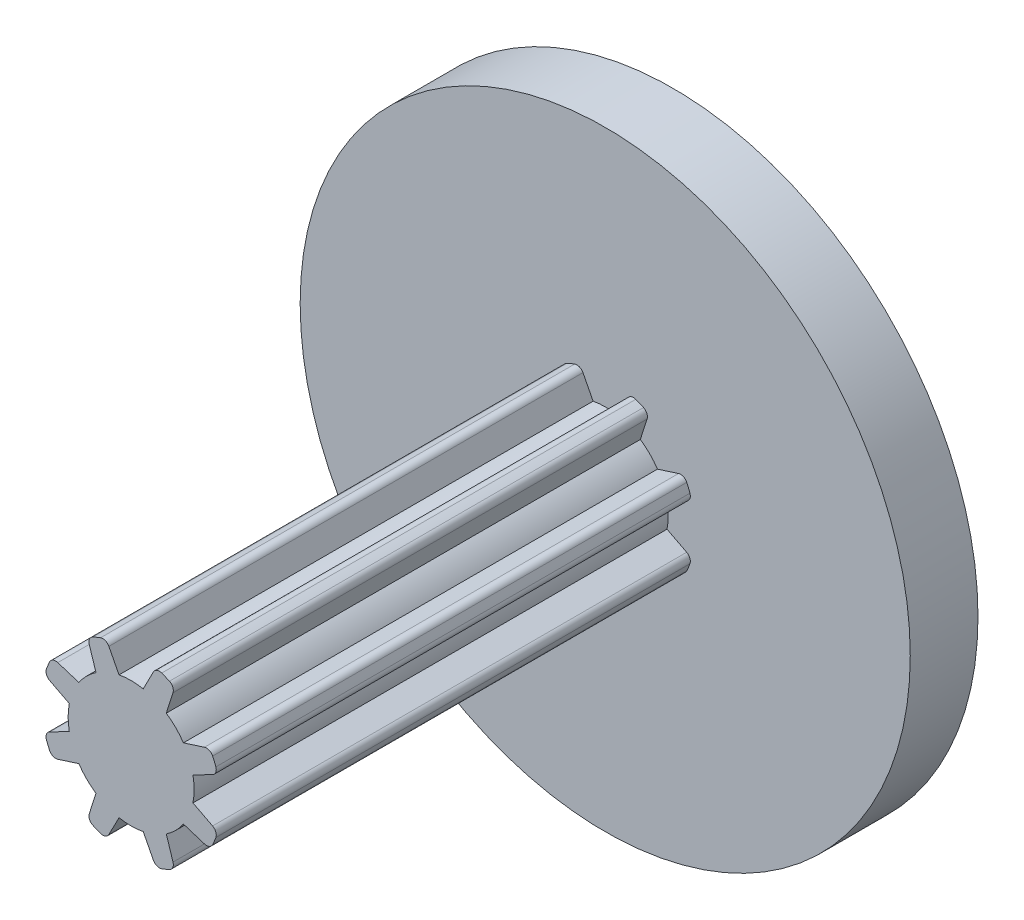
from build123d import *

# Parameters (mm, degrees)
SKETCH2_R           = 4.137132353
BOSS_EXTRUDE1_DEPTH = 40
SKETCH2_4_R         = 22.521813525
BOSS_EXTRUDE2_DEPTH = 5
BOSS_EXTRUDE3_DEPTH = 35
SKETCH6_R           = 3.1
CUT_EXTRUDE1_DEPTH  = 17


with BuildPart() as part:
    # Sketch2 → Boss-Extrude1 (new body)
    with BuildSketch(Plane.XY.offset(-16.453858319)):
        Circle(SKETCH2_R)
    extrude(amount=BOSS_EXTRUDE1_DEPTH)

    # Sketch2<4> → Boss-Extrude2 (add)
    with BuildSketch(Plane.XY.offset(-16.453858319)):
        Circle(SKETCH2_4_R)
    extrude(amount=BOSS_EXTRUDE2_DEPTH)

    # Sketch5 → Boss-Extrude3 (add)
    with BuildSketch(Plane.XY.offset(-11.453858319)):
        with BuildLine():
            Line((3.09152076, 5.413957434), (2.594362934, 3.858987039))
            ThreePointArc((2.594362934, 3.858987039), (3.287908356, 3.288184703), (3.85876898, 2.594687257))
            Line((3.85876898, 2.594687257), (5.413697585, 3.091975771))
            ThreePointArc((5.413697585, 3.091975771), (5.765755257, 3.074104639), (6.018526007, 2.828399672))
            ThreePointArc((6.018526007, 2.828399672), (6.143691944, 2.545103004), (6.25553153, 2.256285725))
            ThreePointArc((6.25553153, 2.256285725), (6.250564892, 1.903809747), (6.014281308, 1.642210721))
            Line((6.014281308, 1.642210721), (4.563207527, 0.894224281))
            ThreePointArc((4.563207527, 0.894224281), (4.649999996, 0.000195407), (4.563282667, -0.893840758))
            Line((4.563282667, -0.893840758), (6.014419308, -1.641705239))
            ThreePointArc((6.014419308, -1.641705239), (6.250724877, -1.903284405), (6.25572114, -2.255759964))
            ThreePointArc((6.25572114, -2.255759964), (6.143905828, -2.544586642), (6.018763701, -2.827893829))
            ThreePointArc((6.018763701, -2.827893829), (5.766013604, -3.073620039), (5.413957434, -3.09152076))
            Line((5.413957434, -3.09152076), (3.858987039, -2.594362934))
            ThreePointArc((3.858987039, -2.594362934), (3.288184703, -3.287908356), (2.594687257, -3.85876898))
            Line((2.594687257, -3.85876898), (3.091975771, -5.413697585))
            ThreePointArc((3.091975771, -5.413697585), (3.074104639, -5.765755257), (2.828399672, -6.018526007))
            ThreePointArc((2.828399672, -6.018526007), (2.545103004, -6.143691944), (2.256285725, -6.25553153))
            ThreePointArc((2.256285725, -6.25553153), (1.903809747, -6.250564892), (1.642210721, -6.014281308))
            Line((1.642210721, -6.014281308), (0.894224281, -4.563207527))
            ThreePointArc((0.894224281, -4.563207527), (0.000195407, -4.649999996), (-0.893840758, -4.563282667))
            Line((-0.893840758, -4.563282667), (-1.641705239, -6.014419308))
            ThreePointArc((-1.641705239, -6.014419308), (-1.903284405, -6.250724877), (-2.255759964, -6.25572114))
            ThreePointArc((-2.255759964, -6.25572114), (-2.544586642, -6.143905828), (-2.827893829, -6.018763701))
            ThreePointArc((-2.827893829, -6.018763701), (-3.073620039, -5.766013604), (-3.09152076, -5.413957434))
            Line((-3.09152076, -5.413957434), (-2.594362934, -3.858987039))
            ThreePointArc((-2.594362934, -3.858987039), (-3.287908356, -3.288184703), (-3.85876898, -2.594687257))
            Line((-3.85876898, -2.594687257), (-5.413697585, -3.091975771))
            ThreePointArc((-5.413697585, -3.091975771), (-5.765755257, -3.074104639), (-6.018526007, -2.828399672))
            ThreePointArc((-6.018526007, -2.828399672), (-6.143691944, -2.545103004), (-6.25553153, -2.256285725))
            ThreePointArc((-6.25553153, -2.256285725), (-6.250564892, -1.903809747), (-6.014281308, -1.642210721))
            Line((-6.014281308, -1.642210721), (-4.563207527, -0.894224281))
            ThreePointArc((-4.563207527, -0.894224281), (-4.649999996, -0.000195407), (-4.563282667, 0.893840758))
            Line((-4.563282667, 0.893840758), (-6.014419308, 1.641705239))
            ThreePointArc((-6.014419308, 1.641705239), (-6.250724877, 1.903284405), (-6.25572114, 2.255759964))
            ThreePointArc((-6.25572114, 2.255759964), (-6.143905828, 2.544586642), (-6.018763701, 2.827893829))
            ThreePointArc((-6.018763701, 2.827893829), (-5.766013604, 3.073620039), (-5.413957434, 3.09152076))
            Line((-5.413957434, 3.09152076), (-3.858987039, 2.594362934))
            ThreePointArc((-3.858987039, 2.594362934), (-3.288184703, 3.287908356), (-2.594687257, 3.85876898))
            Line((-2.594687257, 3.85876898), (-3.091975771, 5.413697585))
            ThreePointArc((-3.091975771, 5.413697585), (-3.074104639, 5.765755257), (-2.828399672, 6.018526007))
            ThreePointArc((-2.828399672, 6.018526007), (-2.545103004, 6.143691944), (-2.256285725, 6.25553153))
            ThreePointArc((-2.256285725, 6.25553153), (-1.903809747, 6.250564892), (-1.642210721, 6.014281308))
            Line((-1.642210721, 6.014281308), (-0.894224281, 4.563207527))
            ThreePointArc((-0.894224281, 4.563207527), (-0.000195407, 4.649999996), (0.893840758, 4.563282667))
            Line((0.893840758, 4.563282667), (1.641705239, 6.014419308))
            ThreePointArc((1.641705239, 6.014419308), (1.903284405, 6.250724877), (2.255759964, 6.25572114))
            ThreePointArc((2.255759964, 6.25572114), (2.544586642, 6.143905828), (2.827893829, 6.018763701))
            ThreePointArc((2.827893829, 6.018763701), (3.073620039, 5.766013604), (3.09152076, 5.413957434))
        make_face()
    extrude(amount=BOSS_EXTRUDE3_DEPTH)

    # Sketch6 → Cut-Extrude1 (cut)
    with BuildSketch(Plane(origin=(0, 0, -16.453858319), x_dir=(-1, 0, 0), z_dir=(0, 0, -1))):
        Circle(SKETCH6_R)
    extrude(amount=-CUT_EXTRUDE1_DEPTH, mode=Mode.SUBTRACT)


solid = part.part
